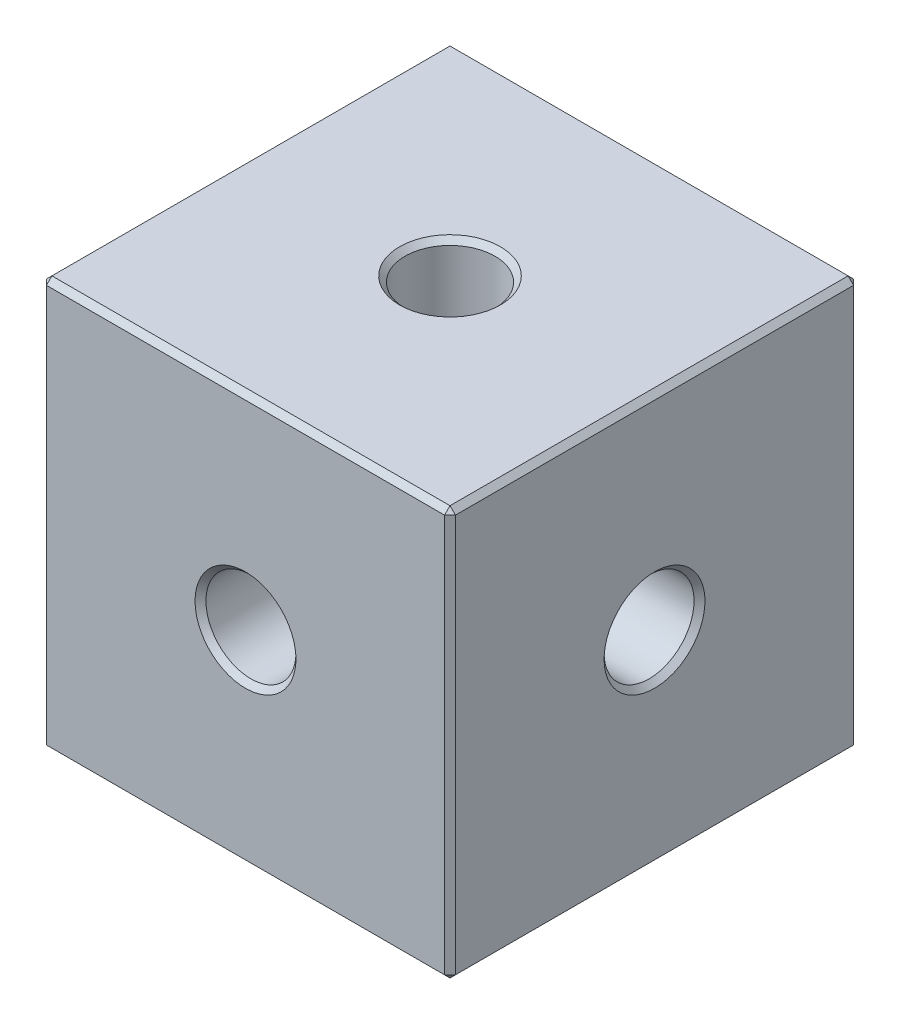
from build123d import *

# Parameters (mm, degrees)
SKETCH_1_W         = 15
SKETCH_1_H         = 15
EXTRUDE_1_DEPTH    = 7.5
HOLE_WIZARD_M4_1_D = 3.3
HOLE_WIZARD_M4_2_D = 3.3
HOLE_WIZARD_M4_3_D = 3.3
CHAMFER_1_SIZE     = 0.2


with BuildPart() as part:
    # 草图1 → 凸台-拉伸1 (new, symmetric)
    with BuildSketch(Plane(origin=(0, 0, 0), x_dir=(1, 0, 0), z_dir=(0, 1, 0))):
        Rectangle(SKETCH_1_W, SKETCH_1_H)
    extrude(amount=EXTRUDE_1_DEPTH, both=True)

    # M4 螺纹孔1 (through all)
    with Locations(Plane.XY.offset(7.5)):
        with Locations((0, 0)):
            Hole(HOLE_WIZARD_M4_1_D / 2)

    # M4 螺纹孔2 (through all)
    with Locations(Plane(origin=(0, 7.5, 0), x_dir=(1, 0, 0), z_dir=(0, 1, 0))):
        with Locations((0, 0)):
            Hole(HOLE_WIZARD_M4_2_D / 2)

    # M4 螺纹孔3 (through all)
    with Locations(Plane(origin=(7.5, 0, 0), x_dir=(0, 0, -1), z_dir=(1, 0, 0))):
        with Locations((0, 0)):
            Hole(HOLE_WIZARD_M4_3_D / 2)

    # 倒角1
    chamfer_1_edges = [part.edges().sort_by_distance(p)[0] for p in [
        (-7.5, 7.5, 0),
        (1.65, 0, 7.5),
        (1.65, 0, -7.5),
        (0, 7.5, 7.5),
        (1.65, -7.5, 0),
        (1.65, 7.5, 0),
        (-7.5, 0, -1.65),
        (7.5, 0, -1.65),
        (7.5, 7.5, 0),
        (0, -7.5, 7.5),
        (-7.5, -7.5, 0),
        (0, -7.5, -7.5),
        (7.5, -7.5, 0),
        (7.5, 0, 7.5),
        (-7.5, 0, 7.5),
        (-7.5, 0, -7.5),
        (7.5, 0, -7.5),
        (0, 7.5, -7.5),
    ]]
    chamfer(chamfer_1_edges, length=CHAMFER_1_SIZE)


solid = part.part
